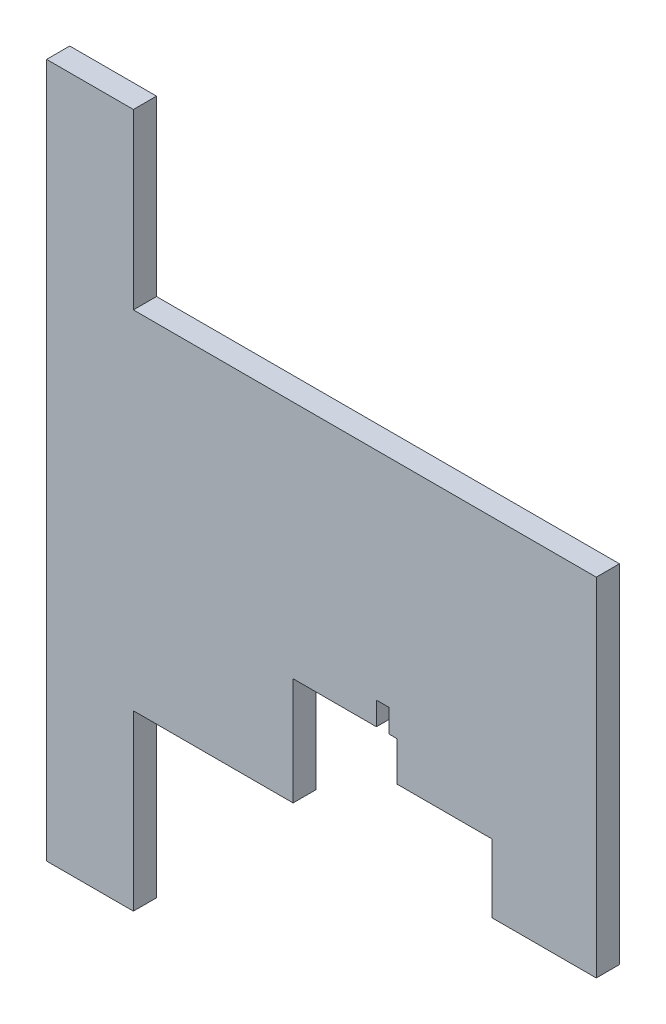
from build123d import *

# Parameters (mm, degrees)
BOSS_EXTRUDE1_DEPTH     = 5.08
CUT_EXTRUDE1_DEPTH      = 154.012602095
CUT_EXTRUDE1_DEPTH_BACK = 154.012602095


with BuildPart() as part:
    # Sketch1 → Boss-Extrude1 (new body)
    with BuildSketch(Plane.XY):
        Polygon((0, 0), (101.6, 0), (101.6, -76.2), (0, -76.2), (0, -114.3), (-19.05, -114.3), (-19.05, 38.1), (0, 38.1), align=None)
    extrude(amount=BOSS_EXTRUDE1_DEPTH)

    # Sketch2 → Cut-Extrude1 (cut, two sides: drawn at the far end of the back side and taken through both)
    with BuildSketch(Plane.XY.offset(5.08).offset(-CUT_EXTRUDE1_DEPTH_BACK)):
        Polygon((35.052, -76.2), (35.052, -52.578), (53.34, -52.578), (53.34, -47.498), (56.134, -47.498), (56.134, -52.578), (57.912, -52.578), (57.912, -61.214), (78.74, -61.214), (78.74, -76.2), align=None)
    extrude(amount=CUT_EXTRUDE1_DEPTH + CUT_EXTRUDE1_DEPTH_BACK, mode=Mode.SUBTRACT)


solid = part.part
